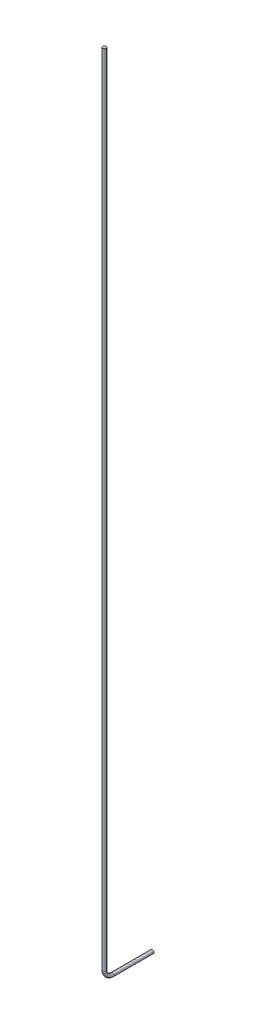
from build123d import *

# Parameters (mm, degrees)
SKETCH_1_R      = 1.06
EXTRUDE_1_DEPTH = 20
SKETCH_2_R      = 1.06


with BuildPart() as part:
    # ｽｹｯﾁ1 → ﾎﾞｽ - 押し出し1 (new body)
    with BuildSketch(Plane.XY):
        Circle(SKETCH_1_R)
    extrude(amount=EXTRUDE_1_DEPTH)

    # ｽｲｰﾌﾟ1: sweep along a path in ｽｹｯﾁ3
    with BuildLine(Plane(origin=(0, 0, 0), x_dir=(0, 0, -1), z_dir=(1, 0, 0))) as sweep_1_path:
        Line((-20, 0), (-25, 0))
        ThreePointArc((-25, 0), (-28.535533906, 1.464466094), (-30, 5))
        Line((-30, 5), (-30, 505))
    # ｽｹｯﾁ2 → ｽｲｰﾌﾟ1 (sweep)
    with BuildSketch(Plane.XY.offset(20)):
        Circle(SKETCH_2_R)
    sweep(path=sweep_1_path.line)


solid = part.part
